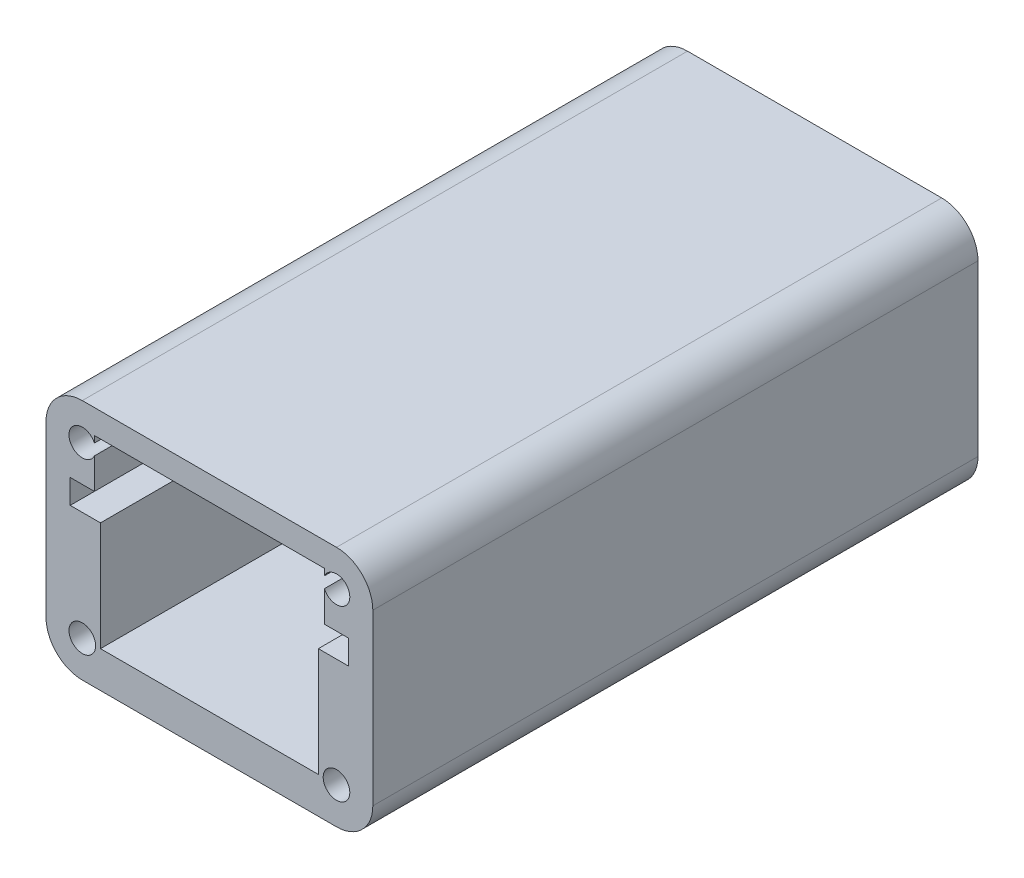
from build123d import *

# Parameters (mm, degrees)
SKETCH1_W               = 27
SKETCH1_H               = 20
BOSS_EXTRUDE1_DEPTH     = 50
SKETCH2_W               = 19
SKETCH2_H               = 14
BOSS_EXTRUDE2_DEPTH     = 2
SKETCH3_W               = 23
SKETCH3_H               = 2
CUT_EXTRUDE1_DEPTH      = 48
SKETCH4_W               = 0.5
SKETCH4_H               = 9
SKETCH4_W_2             = 19
SKETCH4_H_2             = 0.5
BOSS_EXTRUDE3_DEPTH     = 48
FILLET1_R               = 3
SKETCH6_R               = 1.1
CUT_EXTRUDE2_DEPTH      = 6
CUT_EXTRUDE3_DEPTH      = 61.241181927
CUT_EXTRUDE3_DEPTH_BACK = 48
SKETCH14_W              = 19
SKETCH14_H              = 1.5


with BuildPart() as part:
    # Sketch1 → Boss-Extrude1 (new body)
    with BuildSketch(Plane.XY):
        with Locations((13.5, 10)):
            Rectangle(SKETCH1_W, SKETCH1_H)
        Polygon((4, 17), (23, 17), (23, 16), (23, 4), (23, 3), (4, 3), (4, 4), (4, 16), align=None, mode=Mode.SUBTRACT)
    extrude(amount=-BOSS_EXTRUDE1_DEPTH)

    # Sketch2 → Boss-Extrude2 (add)
    with BuildSketch(Plane(origin=(0, 0, -50), x_dir=(-1, 0, 0), z_dir=(0, 0, -1))):
        with Locations((-13.5, 10)):
            Rectangle(SKETCH2_W, SKETCH2_H)
    extrude(amount=-BOSS_EXTRUDE2_DEPTH)

    # Sketch3 → Cut-Extrude1 (cut)
    with BuildSketch(Plane.XY):
        with Locations((13.5, 13)):
            Rectangle(SKETCH3_W, SKETCH3_H)
    extrude(amount=-CUT_EXTRUDE1_DEPTH, mode=Mode.SUBTRACT)

    # Sketch4 → Boss-Extrude3 (add)
    with BuildSketch(Plane.XY):
        with Locations((4.25, 7.5)):
            Rectangle(SKETCH4_W, SKETCH4_H)
        with Locations((22.75, 7.5)):
            Rectangle(SKETCH4_W, SKETCH4_H)
        with Locations((13.5, 16.75)):
            Rectangle(SKETCH4_W_2, SKETCH4_H_2)
    extrude(amount=-BOSS_EXTRUDE3_DEPTH)

    # Fillet1
    fillet1_edges = [part.edges().sort_by_distance(p)[0] for p in [
        (0, 0, -25),
        (0, 20, -25),
        (27, 20, -25),
        (27, 0, -25),
    ]]
    fillet(fillet1_edges, radius=FILLET1_R)

    # Sketch6 → Cut-Extrude2 (cut)
    with BuildSketch(Plane.XY):
        with Locations((3, 17)):
            Circle(SKETCH6_R)
        with Locations((24, 17)):
            Circle(SKETCH6_R)
        with Locations((24, 3)):
            Circle(SKETCH6_R)
        with Locations((3, 3)):
            Circle(SKETCH6_R)
    extrude(amount=-CUT_EXTRUDE2_DEPTH, mode=Mode.SUBTRACT)

    # Sketch14 → Cut-Extrude3 (cut, two sides: drawn at the far end of the back side and taken through both)
    with BuildSketch(Plane.XY.offset(-CUT_EXTRUDE3_DEPTH_BACK)):
        with Locations((13.5, 17.25)):
            Rectangle(SKETCH14_W, SKETCH14_H)
    extrude(amount=CUT_EXTRUDE3_DEPTH + CUT_EXTRUDE3_DEPTH_BACK, mode=Mode.SUBTRACT)


solid = part.part
